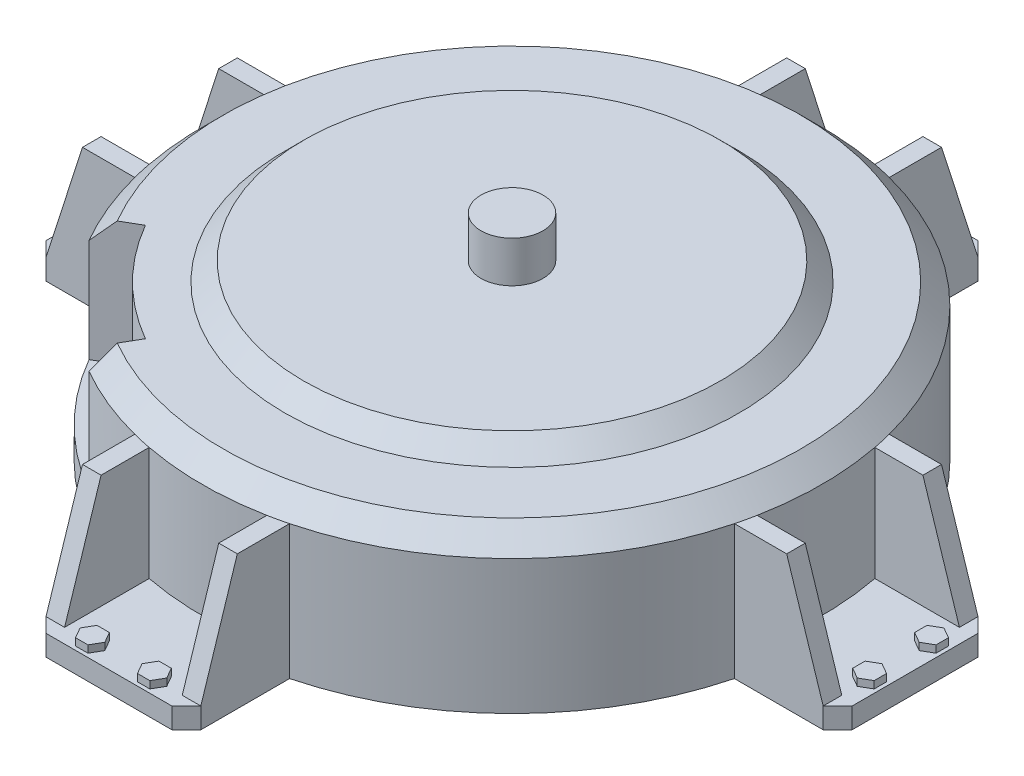
from build123d import *

# Parameters (mm, degrees)
SKETCH1_R                    = 150
BOSS_EXTRUDE1_DEPTH          = 75
CHAMFER1_SIZE                = 10
BOSS_EXTRUDE2_START          = -75
BOSS_EXTRUDE2_DEPTH          = 10
CHAMFER2_SIZE                = 7
BOSS_EXTRUDE3_DEPTH          = 9
BOSS_EXTRUDE4_DEPTH          = 3.5
CIRPATTERN1_COUNT            = 4
CIRPATTERN1_COPY_1_DEPTH     = 9
CIRPATTERN1_COPY_2_DEPTH     = 9
CIRPATTERN1_COPY_3_DEPTH     = 9
CIRPATTERN1_COPY_4_DEPTH     = 3.5
CIRPATTERN1_COPY_5_DEPTH     = 3.5
CIRPATTERN1_COPY_6_DEPTH     = 3.5
CHAMFER2_OF_CIRPATTERN1_SIZE = 7
CUT_EXTRUDE1_START           = -60
CUT_EXTRUDE1_DEPTH           = 60
SKETCH7_R                    = 110
BOSS_EXTRUDE5_DEPTH          = 9
BOSS_EXTRUDE5_TAPER          = 45
SKETCH8_R                    = 15
BOSS_EXTRUDE6_DEPTH          = 20


with BuildPart() as part:
    # Sketch1 → Boss-Extrude1 (new body)
    with BuildSketch(Plane(origin=(0, 0, 0), x_dir=(1, 0, 0), z_dir=(0, 1, 0))):
        with Locations(Location((0, 0, 0), (0, 0, 270))):
            Circle(SKETCH1_R)
    extrude(amount=BOSS_EXTRUDE1_DEPTH)

    # Chamfer1
    chamfer1_edges = [part.edges().sort_by_distance(p)[0] for p in [
        (0, 75, -150),
    ]]
    chamfer(chamfer1_edges, length=CHAMFER1_SIZE)

    # Sketch2 → Boss-Extrude2 (add)
    with BuildSketch(Plane(origin=(0, 75, 0), x_dir=(1, 0, 0), z_dir=(0, 1, 0)).offset(BOSS_EXTRUDE2_START)):
        with BuildLine():
            Line((-195.236875483, 0), (-150, 0))
            ThreePointArc((-150, 0), (-148.80445444, 18.900643872), (-145.236875483, 37.5))
            Line((-145.236875483, 37.5), (-195.236875483, 37.5))
            Line((-195.236875483, 37.5), (-195.236875483, 0))
        make_face()
        with BuildLine():
            ThreePointArc((-145.236875483, -37.5), (-148.80445444, -18.900643872), (-150, 0))
            Line((-150, 0), (-195.236875483, 0))
            Line((-195.236875483, 0), (-195.236875483, -37.5))
            Line((-195.236875483, -37.5), (-145.236875483, -37.5))
        make_face()
    boss_extrude2 = extrude(amount=BOSS_EXTRUDE2_DEPTH)

    # Chamfer2
    chamfer2_edges = [part.edges().sort_by_distance(p)[0] for p in [
        (-195.236875483, 5, -37.5),
        (-195.236875483, 5, 37.5),
    ]]
    chamfer(chamfer2_edges, length=CHAMFER2_SIZE)

    # Sketch3 → Boss-Extrude3 (add)
    with BuildSketch(Plane.XY.offset(37.5)):
        Polygon((-188.236875483, 10), (-145.236875483, 10), (-145.236875483, 65), (-170.556875483, 65), align=None)
    boss_extrude3 = extrude(amount=-BOSS_EXTRUDE3_DEPTH)

    # Sketch5 → Boss-Extrude4 (add)
    with BuildSketch(Plane(origin=(0, 10, 0), x_dir=(1, 0, 0), z_dir=(0, 1, 0))):
        Polygon((-183.04072306, -18), (-183.04072306, -12), (-188.236875483, -9), (-193.433027905, -12), (-193.433027905, -18), (-188.236875483, -21), align=None)
    boss_extrude4 = extrude(amount=BOSS_EXTRUDE4_DEPTH)

    # Mirror1: Boss-Extrude3, Boss-Extrude4 across plane
    add(boss_extrude3.mirror(Plane.XY))
    add(boss_extrude4.mirror(Plane.XY))

    # CirPattern1: Boss-Extrude2, Boss-Extrude3, Boss-Extrude4 ×4 about axis
    cirpattern1_axis = Axis((0, 0, 0), (0, 1, 0))
    add([boss_extrude2.rotate(cirpattern1_axis, i * 360 / CIRPATTERN1_COUNT) for i in range(1, CIRPATTERN1_COUNT)])
    add([boss_extrude3.rotate(cirpattern1_axis, i * 360 / CIRPATTERN1_COUNT) for i in range(1, CIRPATTERN1_COUNT)])
    add([boss_extrude4.rotate(cirpattern1_axis, i * 360 / CIRPATTERN1_COUNT) for i in range(1, CIRPATTERN1_COUNT)])

    # CirPattern1 copy 1 sketch → CirPattern1 copy 1 (add)
    with BuildSketch(Plane(origin=(-37.5, 0, 0), x_dir=(0, 0, -1), z_dir=(-1, 0, 0))):
        Polygon((-188.236875483, -10), (-145.236875483, -10), (-145.236875483, -65), (-170.556875483, -65), align=None)
    extrude(amount=-CIRPATTERN1_COPY_1_DEPTH)

    # CirPattern1 copy 2 sketch → CirPattern1 copy 2 (add)
    with BuildSketch(Plane(origin=(0, 0, 37.5), x_dir=(-1, 0, 0), z_dir=(0, 0, 1))):
        Polygon((-188.236875483, -10), (-145.236875483, -10), (-145.236875483, -65), (-170.556875483, -65), align=None)
    extrude(amount=-CIRPATTERN1_COPY_2_DEPTH)

    # CirPattern1 copy 3 sketch → CirPattern1 copy 3 (add)
    with BuildSketch(Plane(origin=(37.5, 0, 0), x_dir=(0, 0, 1), z_dir=(1, 0, 0))):
        Polygon((-188.236875483, -10), (-145.236875483, -10), (-145.236875483, -65), (-170.556875483, -65), align=None)
    extrude(amount=-CIRPATTERN1_COPY_3_DEPTH)

    # CirPattern1 copy 4 sketch → CirPattern1 copy 4 (add)
    with BuildSketch(Plane(origin=(0, 10, 0), x_dir=(0, 0, -1), z_dir=(0, 1, 0))):
        Polygon((-183.04072306, 18), (-183.04072306, 12), (-188.236875483, 9), (-193.433027905, 12), (-193.433027905, 18), (-188.236875483, 21), align=None)
    extrude(amount=CIRPATTERN1_COPY_4_DEPTH)

    # CirPattern1 copy 5 sketch → CirPattern1 copy 5 (add)
    with BuildSketch(Plane(origin=(0, 10, 0), x_dir=(-1, 0, 0), z_dir=(0, 1, 0))):
        Polygon((-183.04072306, 18), (-183.04072306, 12), (-188.236875483, 9), (-193.433027905, 12), (-193.433027905, 18), (-188.236875483, 21), align=None)
    extrude(amount=CIRPATTERN1_COPY_5_DEPTH)

    # CirPattern1 copy 6 sketch → CirPattern1 copy 6 (add)
    with BuildSketch(Plane.ZX.offset(10)):
        Polygon((-183.04072306, 18), (-183.04072306, 12), (-188.236875483, 9), (-193.433027905, 12), (-193.433027905, 18), (-188.236875483, 21), align=None)
    extrude(amount=CIRPATTERN1_COPY_6_DEPTH)

    # Chamfer2 of CirPattern1
    chamfer2_of_cirpattern1_edges = [part.edges().sort_by_distance(p)[0] for p in [
        (-37.5, 5, 195.236875483),
        (37.5, 5, 195.236875483),
        (195.236875483, 5, 37.5),
        (195.236875483, 5, -37.5),
        (37.5, 5, -195.236875483),
        (-37.5, 5, -195.236875483),
    ]]
    chamfer(chamfer2_of_cirpattern1_edges, length=CHAMFER2_OF_CIRPATTERN1_SIZE)

    # Sketch6 → Cut-Extrude1 (cut)
    with BuildSketch(Plane(origin=(0, 75, 0), x_dir=(1, 0, 0), z_dir=(0, 1, 0)).offset(CUT_EXTRUDE1_START)):
        with BuildLine():
            ThreePointArc((-70, -121.24355653), (-98.994949366, -98.994949366), (-121.24355653, -70))
            Line((-121.24355653, -70), (-129.903810568, -75))
            ThreePointArc((-129.903810568, -75), (-106.066017178, -106.066017178), (-75, -129.903810568))
            Line((-75, -129.903810568), (-70, -121.24355653))
        make_face()
        with BuildLine():
            ThreePointArc((-65, -112.583302492), (-91.923881554, -91.923881554), (-112.583302492, -65))
            Line((-112.583302492, -65), (-121.24355653, -70))
            ThreePointArc((-121.24355653, -70), (-98.994949366, -98.994949366), (-70, -121.24355653))
            Line((-70, -121.24355653), (-65, -112.583302492))
        make_face()
    extrude(amount=CUT_EXTRUDE1_DEPTH, mode=Mode.SUBTRACT)

    # Sketch7 → Boss-Extrude5 (add)
    with BuildSketch(Plane(origin=(0, 75, 0), x_dir=(1, 0, 0), z_dir=(0, 1, 0))):
        Circle(SKETCH7_R)
    extrude(amount=BOSS_EXTRUDE5_DEPTH, taper=BOSS_EXTRUDE5_TAPER)

    # Sketch8 → Boss-Extrude6 (add)
    with BuildSketch(Plane(origin=(0, 84, 0), x_dir=(1, 0, 0), z_dir=(0, 1, 0))):
        with Locations(Location((0, 0, 0), (0, 0, 270))):
            Circle(SKETCH8_R)
    extrude(amount=BOSS_EXTRUDE6_DEPTH)


solid = part.part
